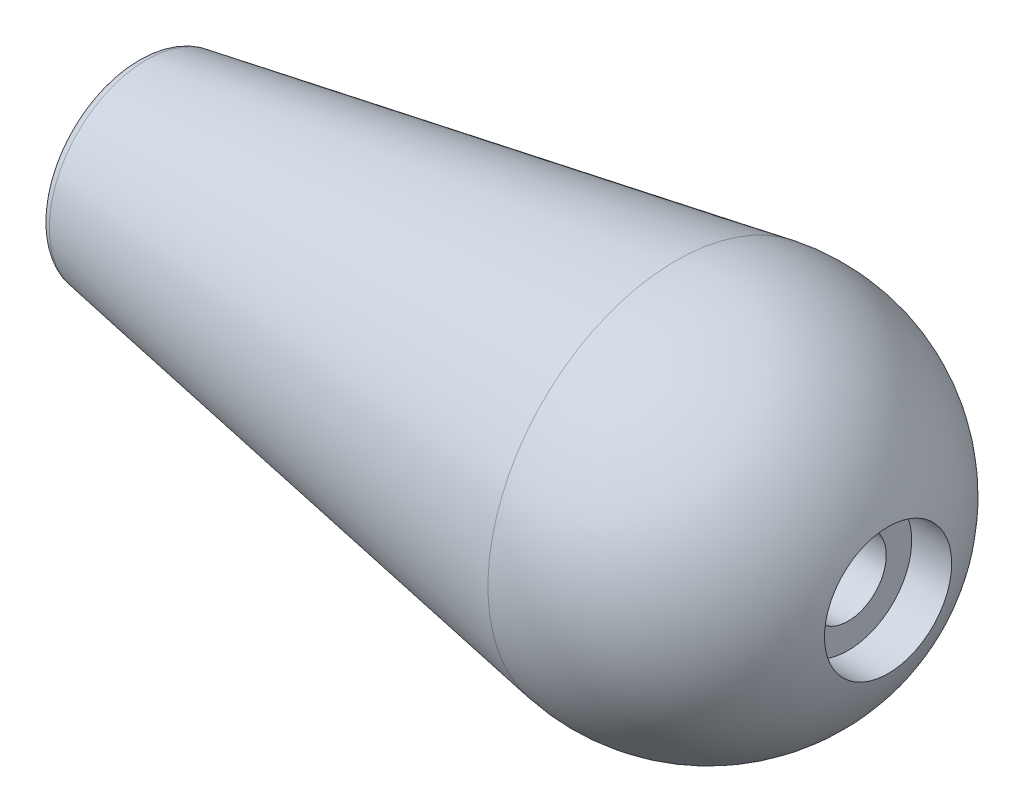
from build123d import *

# Parameters (mm, degrees)
FILLET1_R = 2


with BuildPart() as part:
    # Sketch1 → Revolve2 (revolve)
    with BuildSketch(Plane(origin=(0, 0, 0), x_dir=(1, 0, 0), z_dir=(0, 1, 0))):
        with BuildLine():
            Line((0, 0), (120, 0))
            ThreePointArc((120, 0), (109.337020363, 22.936426127), (84.928023767, 29.568142605))
            Line((84.928023767, 29.568142605), (0, 15))
            Line((0, 15), (0, 0))
        make_face()
    revolve(axis=Axis((0, 0, 0), (1, 0, 0)))

    # Sketch5 → Cut-Revolve1 (revolve, cut)
    with BuildSketch(Plane.XY):
        Polygon((0, 0), (0, 10), (8, 10), (8, 6), (112, 6), (112, 10), (120, 10), (120, 0), align=None)
    revolve(axis=Axis((120, 0, 0), (-1, 0, 0)), mode=Mode.SUBTRACT)

    # Fillet1
    fillet1_edges = [part.edges().sort_by_distance(p)[0] for p in [
        (0, 0, 15),
    ]]
    fillet(fillet1_edges, radius=FILLET1_R)


solid = part.part
